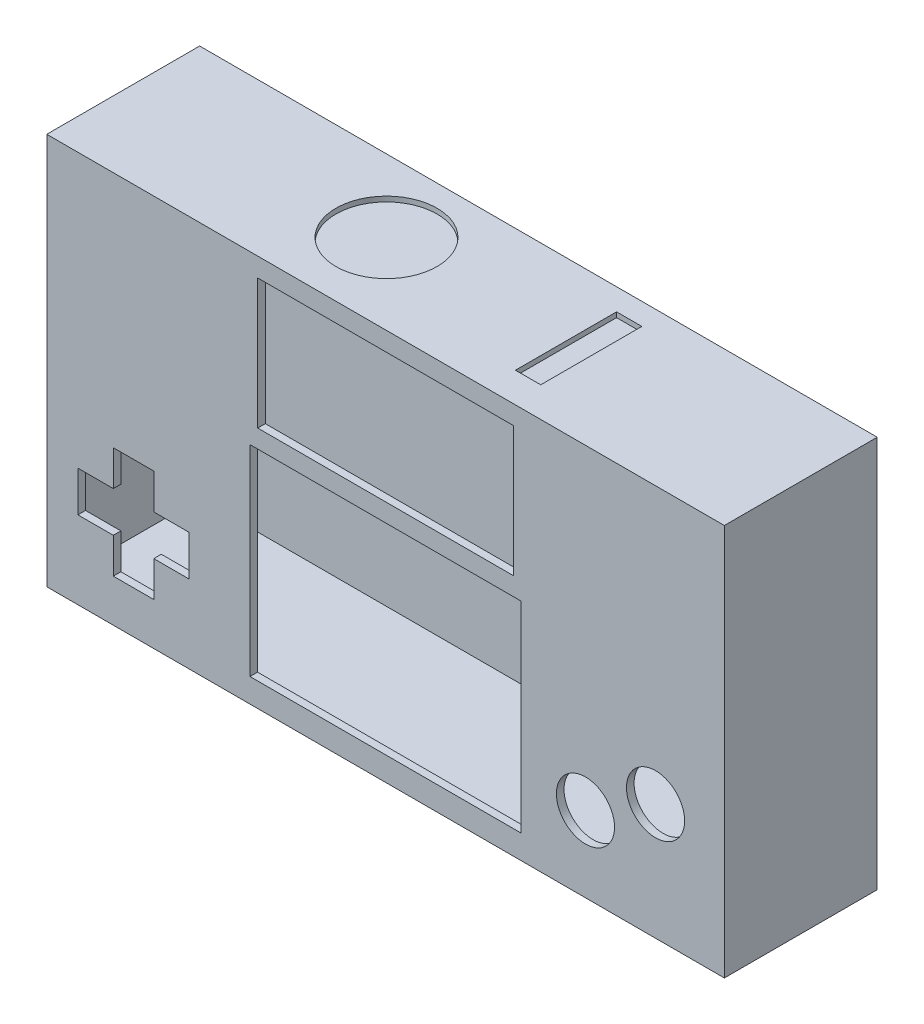
from build123d import *

# Parameters (mm, degrees)
SKETCH1_W           = 131
SKETCH1_H           = 74.5
SKETCH1_R           = 5.75
SKETCH1_W_2         = 50.55
SKETCH1_H_2         = 25.705
SKETCH1_W_3         = 53.61
SKETCH1_H_3         = 39.72
SKETCH1_W_4         = 56.61
SKETCH1_H_4         = 42.72
SKETCH1_W_5         = 53.55
SKETCH1_H_5         = 28.705
BOSS_EXTRUDE1_DEPTH = 1.5
SKETCH1_3_W         = 56.61
SKETCH1_3_H         = 42.72
SKETCH1_3_W_2       = 53.61
SKETCH1_3_H_2       = 39.72
BOSS_EXTRUDE2_DEPTH = 0.000481454
SKETCH1_4_W         = 53.55
SKETCH1_4_H         = 28.705
SKETCH1_4_W_2       = 50.55
SKETCH1_4_H_2       = 25.705
BOSS_EXTRUDE3_DEPTH = 0.000481454
BOSS_EXTRUDE4_START = -27.234481
SKETCH1_5_W         = 134
SKETCH1_5_H         = 77.5
SKETCH1_5_W_2       = 131
SKETCH1_5_H_2       = 74.5
BOSS_EXTRUDE4_DEPTH = 28.734481
BOSS_EXTRUDE5_START = -27.234481
SKETCH1_6_W         = 134
SKETCH1_6_H         = 77.5
BOSS_EXTRUDE5_DEPTH = 1.5
SKETCH2_R           = 10
SKETCH2_W           = 5
SKETCH2_H           = 20
CUT_EXTRUDE1_DEPTH  = 1


with BuildPart() as part:
    # Sketch1 → Boss-Extrude1 (new body)
    # profile 1 of 3: a face of its own
    with BuildSketch(Plane.XY):
        with Locations((49.839986011, 19.347372341)):
            Rectangle(SKETCH1_W, SKETCH1_H)
        with Locations((103.231928001, 3.557382469)):
            Circle(SKETCH1_R, mode=Mode.SUBTRACT)
        with Locations((89.37552154, -4.442617531)):
            Circle(SKETCH1_R, mode=Mode.SUBTRACT)
        with Locations((49.839986011, 41.497872341)):
            Rectangle(SKETCH1_W_2, SKETCH1_H_2, mode=Mode.SUBTRACT)
        with Locations((49.839986011, 5.184101348)):
            Rectangle(SKETCH1_W_3, SKETCH1_H_3, mode=Mode.SUBTRACT)
        Polygon((4, -11), (-4, -11), (-4, -4), (-11, -4), (-11, 4), (-4, 4), (-4, 11), (4, 11), (4, 4), (11, 4), (11, -4), (4, -4), align=None, mode=Mode.SUBTRACT)
    # profile 2 of 3: a face of its own
    with BuildSketch(Plane.XY):
        with Locations((49.839986011, 5.184101348)):
            Rectangle(SKETCH1_W_4, SKETCH1_H_4)
        with Locations((49.839986011, 5.184101348)):
            Rectangle(SKETCH1_W_3, SKETCH1_H_3, mode=Mode.SUBTRACT)
    # profile 3 of 3: a face of its own
    with BuildSketch(Plane.XY):
        with Locations((49.839986011, 41.497872341)):
            Rectangle(SKETCH1_W_5, SKETCH1_H_5)
        with Locations((49.839986011, 41.497872341)):
            Rectangle(SKETCH1_W_2, SKETCH1_H_2, mode=Mode.SUBTRACT)
    extrude(amount=BOSS_EXTRUDE1_DEPTH)

    # Sketch1<3> → Boss-Extrude2 (add)
    with BuildSketch(Plane.XY):
        with Locations((49.839986011, 5.184101348)):
            Rectangle(SKETCH1_3_W, SKETCH1_3_H)
        with Locations((49.839986011, 5.184101348)):
            Rectangle(SKETCH1_3_W_2, SKETCH1_3_H_2, mode=Mode.SUBTRACT)
    extrude(amount=-BOSS_EXTRUDE2_DEPTH)

    # Sketch1<4> → Boss-Extrude3 (add)
    with BuildSketch(Plane.XY):
        with Locations((49.839986011, 41.497872341)):
            Rectangle(SKETCH1_4_W, SKETCH1_4_H)
        with Locations((49.839986011, 41.497872341)):
            Rectangle(SKETCH1_4_W_2, SKETCH1_4_H_2, mode=Mode.SUBTRACT)
    extrude(amount=-BOSS_EXTRUDE3_DEPTH)

    # Sketch1<5> → Boss-Extrude4 (add)
    with BuildSketch(Plane.XY.offset(BOSS_EXTRUDE4_START)):
        with Locations((49.839986011, 19.347372341)):
            Rectangle(SKETCH1_5_W, SKETCH1_5_H)
        with Locations((49.839986011, 19.347372341)):
            Rectangle(SKETCH1_5_W_2, SKETCH1_5_H_2, mode=Mode.SUBTRACT)
    extrude(amount=BOSS_EXTRUDE4_DEPTH)

    # Sketch1<6> → Boss-Extrude5 (add)
    with BuildSketch(Plane.XY.offset(BOSS_EXTRUDE5_START)):
        with Locations((49.839986011, 19.347372341)):
            Rectangle(SKETCH1_6_W, SKETCH1_6_H)
    extrude(amount=-BOSS_EXTRUDE5_DEPTH)

    # Sketch2 → Cut-Extrude1 (cut)
    with BuildSketch(Plane(origin=(0, 58.097372341, 0), x_dir=(1, 0, 0), z_dir=(0, 1, 0))):
        with Locations(Location((34.089986011, 14.434481454, 0), (0, 0, 270))):
            Circle(SKETCH2_R)
        with Locations((72.089986011, 14.434481454)):
            Rectangle(SKETCH2_W, SKETCH2_H)
    extrude(amount=-CUT_EXTRUDE1_DEPTH, mode=Mode.SUBTRACT)


solid = part.part
